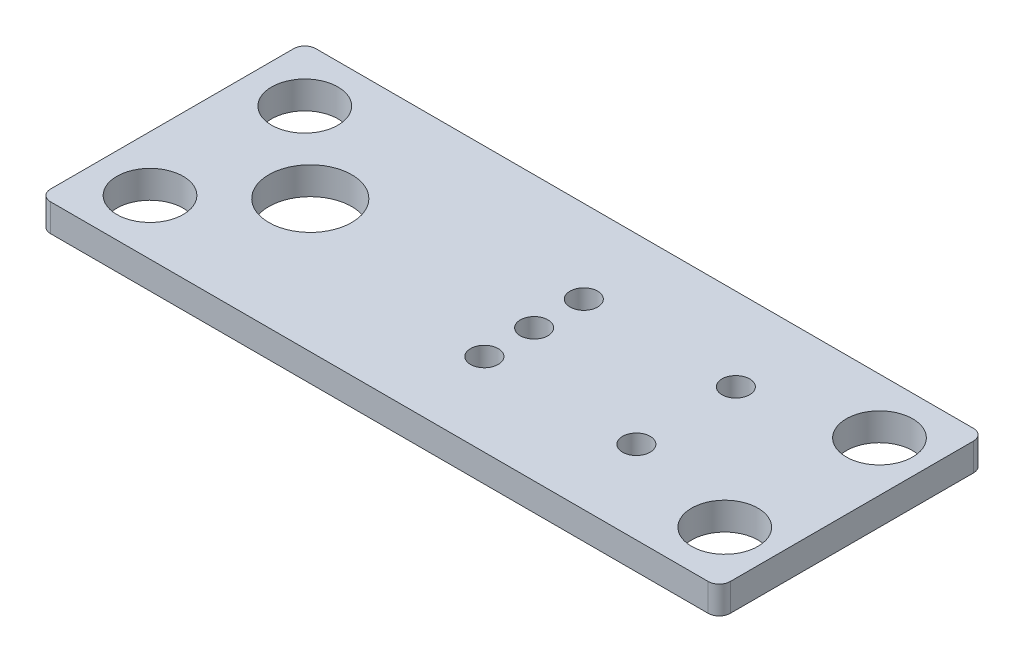
from build123d import *

# Parameters (mm, degrees)
SKETCH1_W           = 123
SKETCH1_H           = 48
SKETCH1_R           = 6
SKETCH1_R_2         = 7.5
SKETCH1_R_3         = 2.5
BOSS_EXTRUDE1_DEPTH = 5
FILLET1_R           = 2


with BuildPart() as part:
    # Sketch1 → Boss-Extrude1 (new body)
    with BuildSketch(Plane(origin=(0, 0, 0), x_dir=(1, 0, 0), z_dir=(0, 1, 0))):
        with Locations((61.5, 24)):
            Rectangle(SKETCH1_W, SKETCH1_H)
        with Locations(Location((10, 10, 0), (0, 0, 270))):
            Circle(SKETCH1_R, mode=Mode.SUBTRACT)
        with Locations(Location((10, 38, 0), (0, 0, 270))):
            Circle(SKETCH1_R, mode=Mode.SUBTRACT)
        with Locations(Location((114, 38, 0), (0, 0, 270))):
            Circle(SKETCH1_R, mode=Mode.SUBTRACT)
        with Locations(Location((114, 10, 0), (0, 0, 270))):
            Circle(SKETCH1_R, mode=Mode.SUBTRACT)
        with Locations(Location((25, 24, 0), (0, 0, 270))):
            Circle(SKETCH1_R_2, mode=Mode.SUBTRACT)
        with Locations(Location((93, 15, 0), (0, 0, 270))):
            Circle(SKETCH1_R_3, mode=Mode.SUBTRACT)
        with Locations(Location((93, 33, 0), (0, 0, 270))):
            Circle(SKETCH1_R_3, mode=Mode.SUBTRACT)
        with Locations(Location((65.5, 15, 0), (0, 0, 270))):
            Circle(SKETCH1_R_3, mode=Mode.SUBTRACT)
        with Locations(Location((65.5, 24, 0), (0, 0, 270))):
            Circle(SKETCH1_R_3, mode=Mode.SUBTRACT)
        with Locations(Location((65.5, 33, 0), (0, 0, 270))):
            Circle(SKETCH1_R_3, mode=Mode.SUBTRACT)
    extrude(amount=BOSS_EXTRUDE1_DEPTH)

    # Fillet1
    fillet1_edges = [part.edges().sort_by_distance(p)[0] for p in [
        (0, 2.5, -48),
        (123, 2.5, -48),
        (123, 2.5, 0),
        (0, 2.5, 0),
    ]]
    fillet(fillet1_edges, radius=FILLET1_R)


solid = part.part
